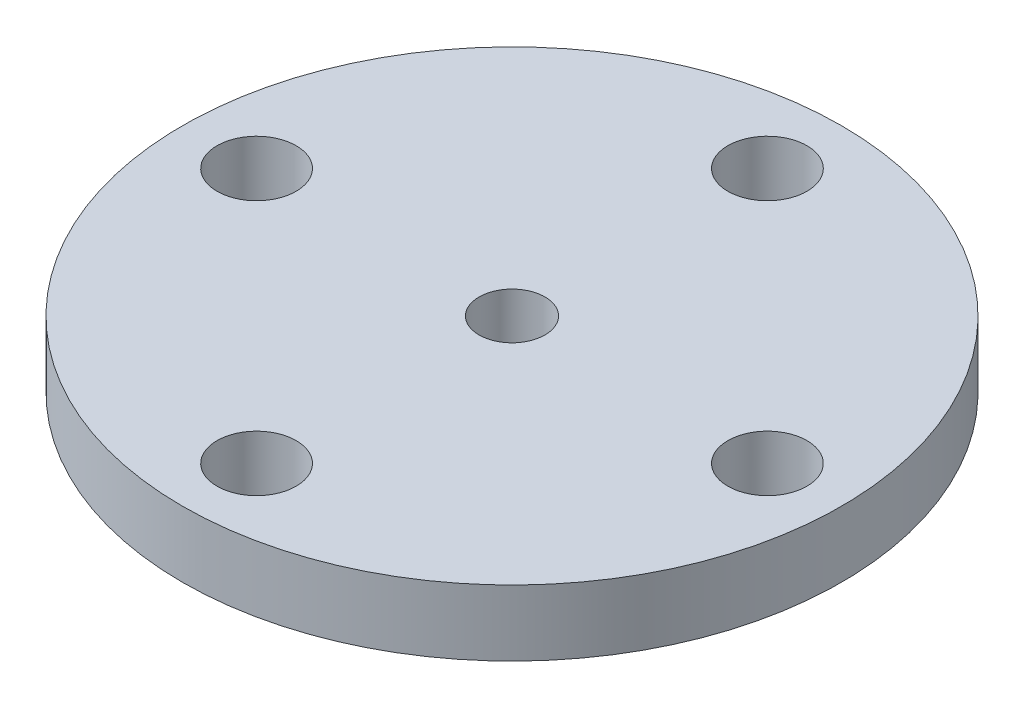
from build123d import *

# Parameters (mm, degrees)
SKETCH_1_R               = 5
EXTRUDE_1_DEPTH          = 1
SKETCH_1_6_R             = 0.5
CUT_EXTRUDE_2_DEPTH      = 8.141428429
SKETCH_1_7_R             = 0.6
CUT_EXTRUDE_3_DEPTH      = 2
PATTERN_CIRCULAR_1_COUNT = 4


with BuildPart() as part:
    # 草图1 → 凸台-拉伸1 (new body)
    with BuildSketch(Plane(origin=(0, 0, 0), x_dir=(1, 0, 0), z_dir=(0, 1, 0))):
        Circle(SKETCH_1_R)
    extrude(amount=EXTRUDE_1_DEPTH)

    # 草图1<6> → 切除-拉伸2 (cut, through all)
    with BuildSketch(Plane(origin=(0, 0, 0), x_dir=(1, 0, 0), z_dir=(0, 1, 0))):
        Circle(SKETCH_1_6_R)
    extrude(amount=CUT_EXTRUDE_2_DEPTH, mode=Mode.SUBTRACT)

    # 草图1<7> → 切除-拉伸3 (cut)
    with BuildSketch(Plane(origin=(0, 0, 0), x_dir=(1, 0, 0), z_dir=(0, 1, 0))):
        with Locations((-3.875, 0)):
            Circle(SKETCH_1_7_R)
    cut_extrude_3 = extrude(amount=CUT_EXTRUDE_3_DEPTH, mode=Mode.SUBTRACT)

    # 阵列(圆周)1: 切除-拉伸3 ×4 about axis
    pattern_circular_1_axis = Axis((0, 1, 0), (0, -1, 0))
    for i in range(1, PATTERN_CIRCULAR_1_COUNT):
        add(cut_extrude_3.rotate(pattern_circular_1_axis, i * 360 / PATTERN_CIRCULAR_1_COUNT), mode=Mode.SUBTRACT)


solid = part.part
